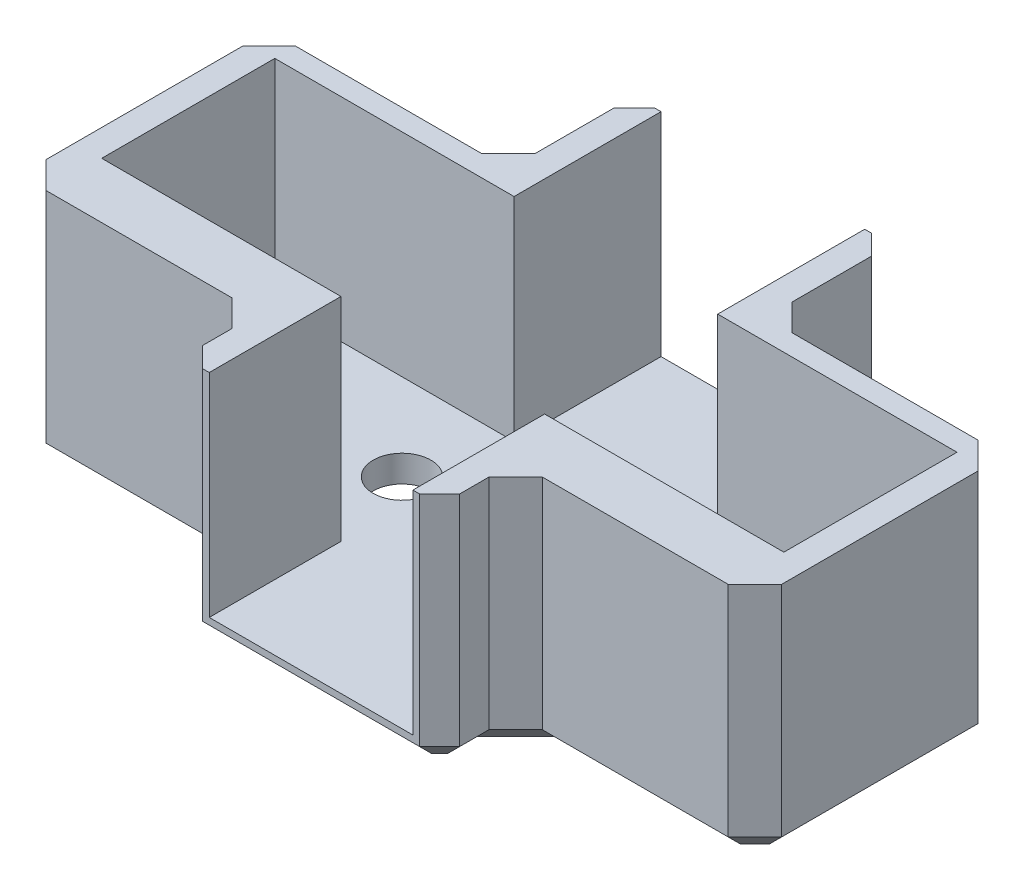
from build123d import *

# Parameters (mm, degrees)
SKETCH1_R           = 2.159
BOSS_EXTRUDE1_DEPTH = 2
BOSS_EXTRUDE2_DEPTH = 15.875
CHAMFER1_SIZE       = 2
CHAMFER2_SIZE       = 2
CHAMFER3_SIZE       = 1.5
CHAMFER4_SIZE       = 1.5
CHAMFER5_SIZE       = 1.5


with BuildPart() as part:
    # Sketch1 → Boss-Extrude1 (new body)
    with BuildSketch(Plane(origin=(0, 0, 0), x_dir=(1, 0, 0), z_dir=(0, 1, 0))):
        Polygon((35.223504259, 33.533672595), (15.983504259, 33.533672595), (15.983504259, 24.107172595), (-1.923495741, 24.107172595), (-1.923495741, 5.411272595), (15.983504259, 5.411272595), (15.983504259, -0.278017555), (35.223504259, -0.278017555), (35.223504259, 5.411272595), (53.130504259, 5.411272595), (53.130504259, 24.107172595), (35.223504259, 24.107172595), align=None)
        with Locations(Location((16.078504259, 16.056672595, 0), (0, 0, 270))):
            Circle(SKETCH1_R, mode=Mode.SUBTRACT)
        with Locations(Location((35.128504259, 16.056672595, 0), (0, 0, 270))):
            Circle(SKETCH1_R, mode=Mode.SUBTRACT)
    extrude(amount=BOSS_EXTRUDE1_DEPTH)

    # Sketch3 → Boss-Extrude2 (add)
    with BuildSketch(Plane(origin=(0, 2, 0), x_dir=(1, 0, 0), z_dir=(0, 1, 0))):
        Polygon((33.223504259, 30.817862745), (33.223504259, 33.533672595), (35.223504259, 33.533672595), (35.223504259, 24.107172595), (53.130504259, 24.107172595), (53.130504259, 5.411272595), (35.223504259, 5.411272595), (35.223504259, -0.278017555), (33.223504259, -0.278017555), (33.223504259, 1.721982445), (33.223504259, 9.579672595), (51.130504259, 9.579672595), (51.130504259, 22.533672595), (33.223504259, 22.533672595), align=None)
        Polygon((17.983504259, 1.721982445), (17.983504259, -0.278017555), (15.983504259, -0.278017555), (15.983504259, 5.411272595), (-1.923495741, 5.411272595), (-1.923495741, 24.107172595), (15.983504259, 24.107172595), (15.983504259, 33.533672595), (17.983504259, 33.533672595), (17.983504259, 29.040712972), (17.983504259, 22.533672595), (0.076504259, 22.533672595), (0.076504259, 9.579672595), (17.983504259, 9.579672595), align=None)
    extrude(amount=BOSS_EXTRUDE2_DEPTH)

    # Chamfer1
    chamfer1_edges = [part.edges().sort_by_distance(p)[0] for p in [
        (53.130504259, 8.9375, -24.107172595),
        (53.130504259, 8.9375, -5.411272595),
        (-1.923495741, 8.9375, -5.411272595),
        (-1.923495741, 8.9375, -24.107172595),
    ]]
    chamfer(chamfer1_edges, length=CHAMFER1_SIZE)

    # Chamfer2
    chamfer2_edges = [part.edges().sort_by_distance(p)[0] for p in [
        (35.223504259, 8.9375, -24.107172595),
        (35.223504259, 8.9375, -5.411272595),
        (15.983504259, 8.9375, -5.411272595),
        (15.983504259, 8.9375, -24.107172595),
    ]]
    chamfer(chamfer2_edges, length=CHAMFER2_SIZE)

    # Chamfer3
    chamfer3_edges = [part.edges().sort_by_distance(p)[0] for p in [
        (15.983504259, 8.9375, -33.533672595),
        (35.223504259, 8.9375, -33.533672595),
    ]]
    chamfer(chamfer3_edges, length=CHAMFER3_SIZE)

    # Chamfer4
    chamfer4_edges = [part.edges().sort_by_distance(p)[0] for p in [
        (35.223504259, 8.9375, 0.278017555),
        (15.983504259, 8.9375, 0.278017555),
    ]]
    chamfer(chamfer4_edges, length=CHAMFER4_SIZE)

    # Chamfer5
    chamfer5_edges = [part.edges().sort_by_distance(p)[0] for p in [
        (53.130504259, 0, -14.759222595),
        (44.177004259, 0, -24.107172595),
        (7.030004259, 0, -5.411272595),
        (-1.923495741, 0, -14.759222595),
        (-0.923495741, 0, -6.411272595),
        (-0.923495741, 0, -23.107172595),
        (52.130504259, 0, -23.107172595),
        (52.130504259, 0, -6.411272595),
        (44.177004259, 0, -5.411272595),
        (15.983504259, 0, -2.31662752),
        (7.030004259, 0, -24.107172595),
        (35.223504259, 0, -29.070422595),
        (36.223504259, 0, -4.411272595),
        (14.983504259, 0, -4.411272595),
        (14.983504259, 0, -25.107172595),
        (36.223504259, 0, -25.107172595),
        (15.983504259, 0, -29.070422595),
        (25.603504259, 0, -33.533672595),
        (34.473504259, 0, -32.783672595),
        (16.733504259, 0, -32.783672595),
        (25.603504259, 0, 0.278017555),
        (35.223504259, 0, -2.31662752),
        (34.473504259, 0, -0.471982445),
        (16.733504259, 0, -0.471982445),
    ]]
    chamfer(chamfer5_edges, length=CHAMFER5_SIZE)


solid = part.part
